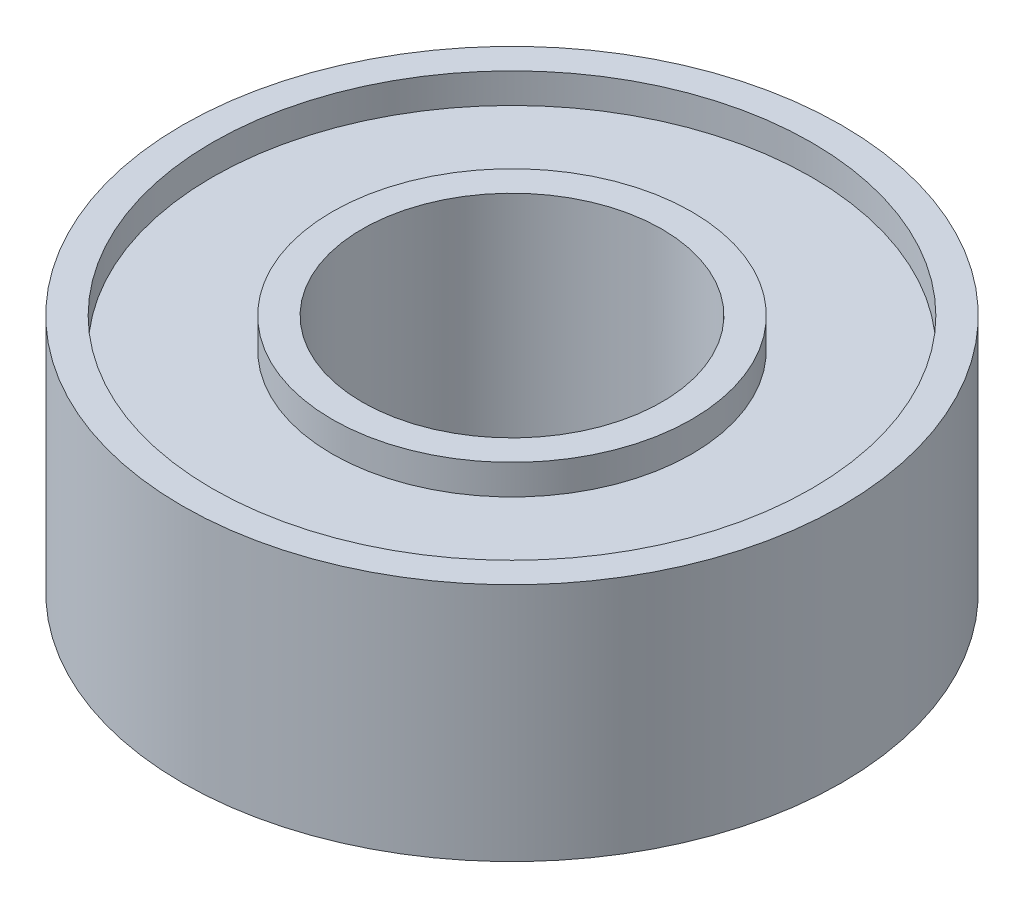
from build123d import *

# Parameters (mm, degrees)
SKETCH1_R           = 5.5
SKETCH1_R_2         = 2.5
BOSS_EXTRUDE1_DEPTH = 4
SKETCH2_R           = 5
SKETCH2_R_2         = 3
CUT_EXTRUDE1_DEPTH  = 0.5
CUT_EXTRUDE2_START  = -3.5
SKETCH2_2_R         = 5
SKETCH2_2_R_2       = 3
CUT_EXTRUDE2_DEPTH  = 0.5


with BuildPart() as part:
    # Sketch1 → Boss-Extrude1 (new body)
    with BuildSketch(Plane(origin=(0, 0, 0), x_dir=(1, 0, 0), z_dir=(0, 1, 0))):
        with Locations(Location((0, 0, 0), (0, 0, 270))):
            Circle(SKETCH1_R)
        with Locations(Location((0, 0, 0), (0, 0, 270))):
            Circle(SKETCH1_R_2, mode=Mode.SUBTRACT)
    extrude(amount=BOSS_EXTRUDE1_DEPTH)

    # Sketch2 → Cut-Extrude1 (cut)
    with BuildSketch(Plane(origin=(0, 4, 0), x_dir=(1, 0, 0), z_dir=(0, 1, 0))):
        with Locations(Location((0, 0, 0), (0, 0, 270))):
            Circle(SKETCH2_R)
        with Locations(Location((0, 0, 0), (0, 0, 270))):
            Circle(SKETCH2_R_2, mode=Mode.SUBTRACT)
    extrude(amount=-CUT_EXTRUDE1_DEPTH, mode=Mode.SUBTRACT)

    # Sketch2<2> → Cut-Extrude2 (cut)
    with BuildSketch(Plane(origin=(0, 4, 0), x_dir=(1, 0, 0), z_dir=(0, 1, 0)).offset(CUT_EXTRUDE2_START)):
        with Locations(Location((0, 0, 0), (0, 0, 270))):
            Circle(SKETCH2_2_R)
        with Locations(Location((0, 0, 0), (0, 0, 270))):
            Circle(SKETCH2_2_R_2, mode=Mode.SUBTRACT)
    extrude(amount=-CUT_EXTRUDE2_DEPTH, mode=Mode.SUBTRACT)


solid = part.part
